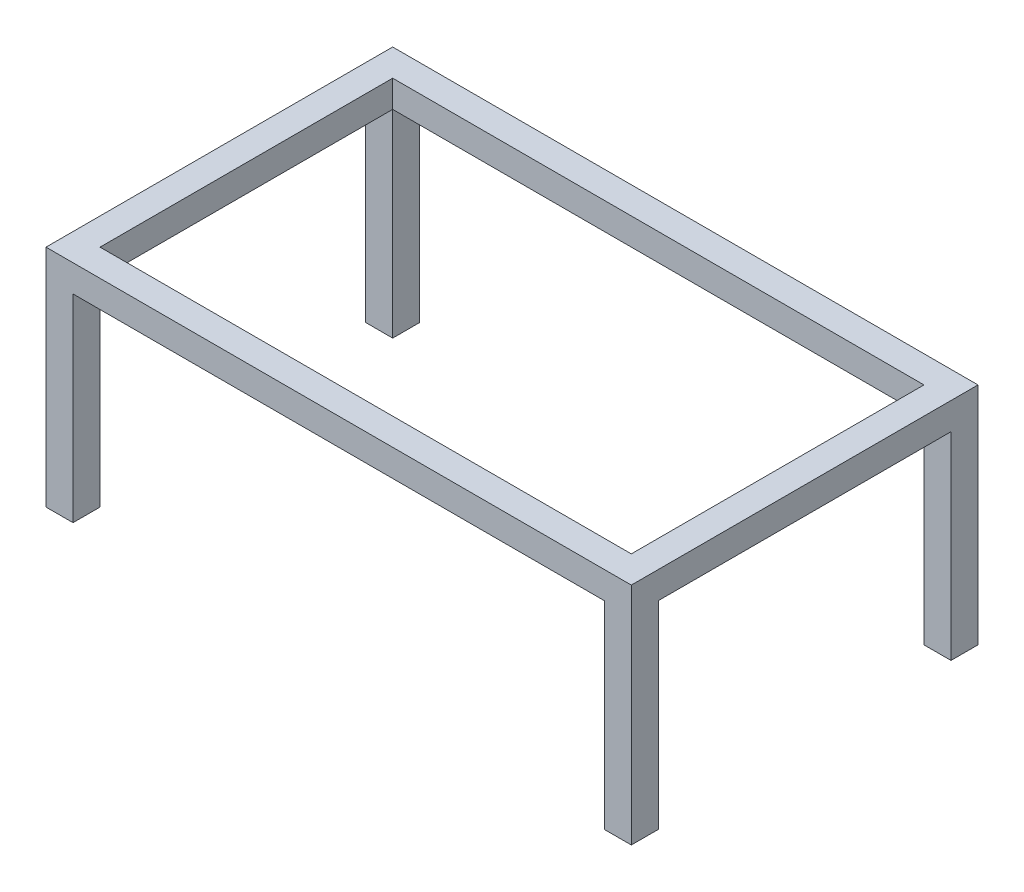
from build123d import *

# Parameters (mm, degrees)
ESQUISSE2_W             = 13000
ESQUISSE2_H             = 7700
BOSS_EXTRU_1_DEPTH      = 5000
ESQUISSE6_W             = 11800
ESQUISSE6_H             = 6500
ENL_V_MAT_EXTRU_2_DEPTH = 5000
ESQUISSE7_W             = 11800
ESQUISSE7_H             = 4400
ENL_V_MAT_EXTRU_3_DEPTH = 15916.087181665
ESQUISSE10_W            = 6500
ESQUISSE10_H            = 4400
ENL_V_MAT_EXTRU_4_DEPTH = 15916.087181665


with BuildPart() as part:
    # Esquisse2 → Boss.-Extru.1 (new body)
    with BuildSketch(Plane(origin=(0, 0, 0), x_dir=(1, 0, 0), z_dir=(0, 1, 0))):
        with Locations((6500, 3850)):
            Rectangle(ESQUISSE2_W, ESQUISSE2_H)
    extrude(amount=-BOSS_EXTRU_1_DEPTH)

    # Esquisse6 → Enlèv. mat.-Extru.2 (cut)
    with BuildSketch(Plane(origin=(0, 0, 0), x_dir=(1, 0, 0), z_dir=(0, 1, 0))):
        with Locations((6500, 3850)):
            Rectangle(ESQUISSE6_W, ESQUISSE6_H)
    extrude(amount=-ENL_V_MAT_EXTRU_2_DEPTH, mode=Mode.SUBTRACT)

    # Esquisse7 → Enlèv. mat.-Extru.3 (cut, through all)
    with BuildSketch(Plane.XY):
        with Locations((6500, -2800)):
            Rectangle(ESQUISSE7_W, ESQUISSE7_H)
    extrude(amount=-ENL_V_MAT_EXTRU_3_DEPTH, mode=Mode.SUBTRACT)

    # Esquisse10 → Enlèv. mat.-Extru.4 (cut, through all)
    with BuildSketch(Plane.ZY):
        with Locations((-3850, -2800)):
            Rectangle(ESQUISSE10_W, ESQUISSE10_H)
    extrude(amount=-ENL_V_MAT_EXTRU_4_DEPTH, mode=Mode.SUBTRACT)


solid = part.part
